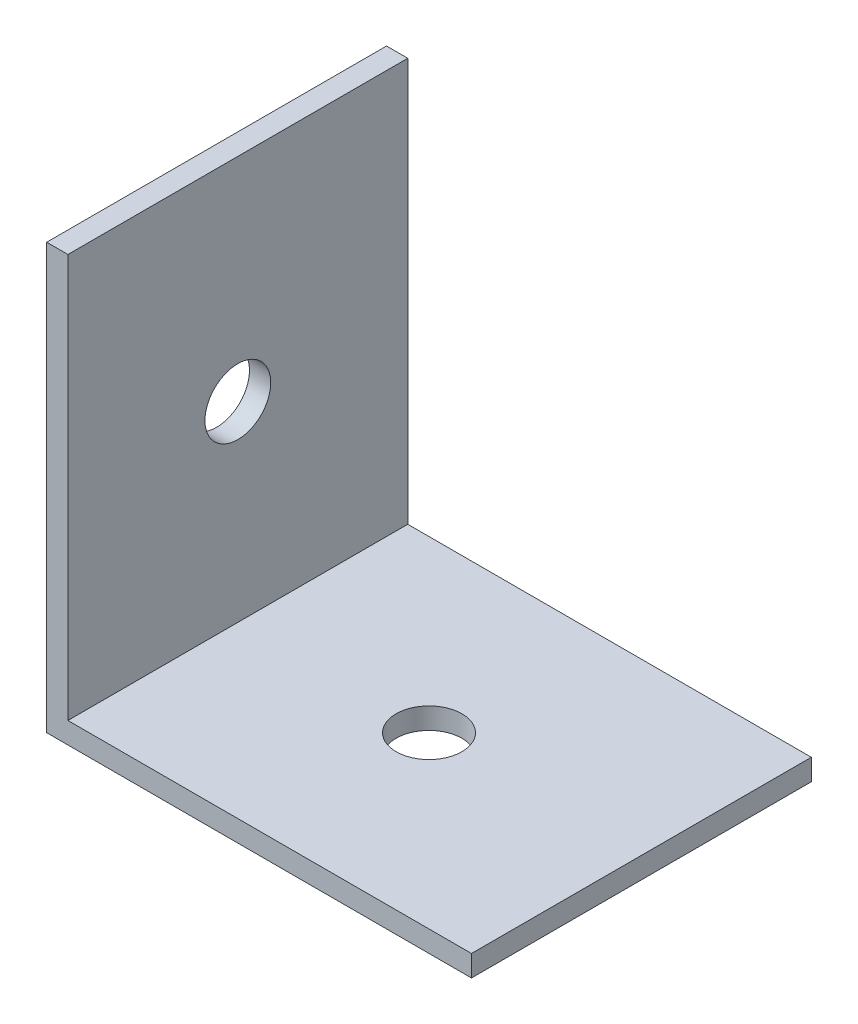
from build123d import *

# Parameters (mm, degrees)
BOSS_EXTRUDE1_DEPTH          = 25.4
F_10_0_1935_DIAMETER_HOLE1_D = 4.9149
F_10_0_1935_DIAMETER_HOLE2_D = 4.9149


with BuildPart() as part:
    # Sketch1 → Boss-Extrude1 (new body)
    with BuildSketch(Plane.XY):
        Polygon((0, 0), (0, 31.75), (1.5875, 31.75), (1.5875, 1.5875), (31.75, 1.5875), (31.75, 0), align=None)
    extrude(amount=BOSS_EXTRUDE1_DEPTH)

    # #10 (0.1935) Diameter Hole1 (through all)
    with Locations(Plane(origin=(0, 0, 0), x_dir=(-1, 0, 0), z_dir=(0, -1, 0))):
        with Locations((-15.875, -12.7)):
            Hole(F_10_0_1935_DIAMETER_HOLE1_D / 2)

    # #10 (0.1935) Diameter Hole2 (through all)
    with Locations(Plane.ZY):
        with Locations((12.7, 15.875)):
            Hole(F_10_0_1935_DIAMETER_HOLE2_D / 2)


solid = part.part
